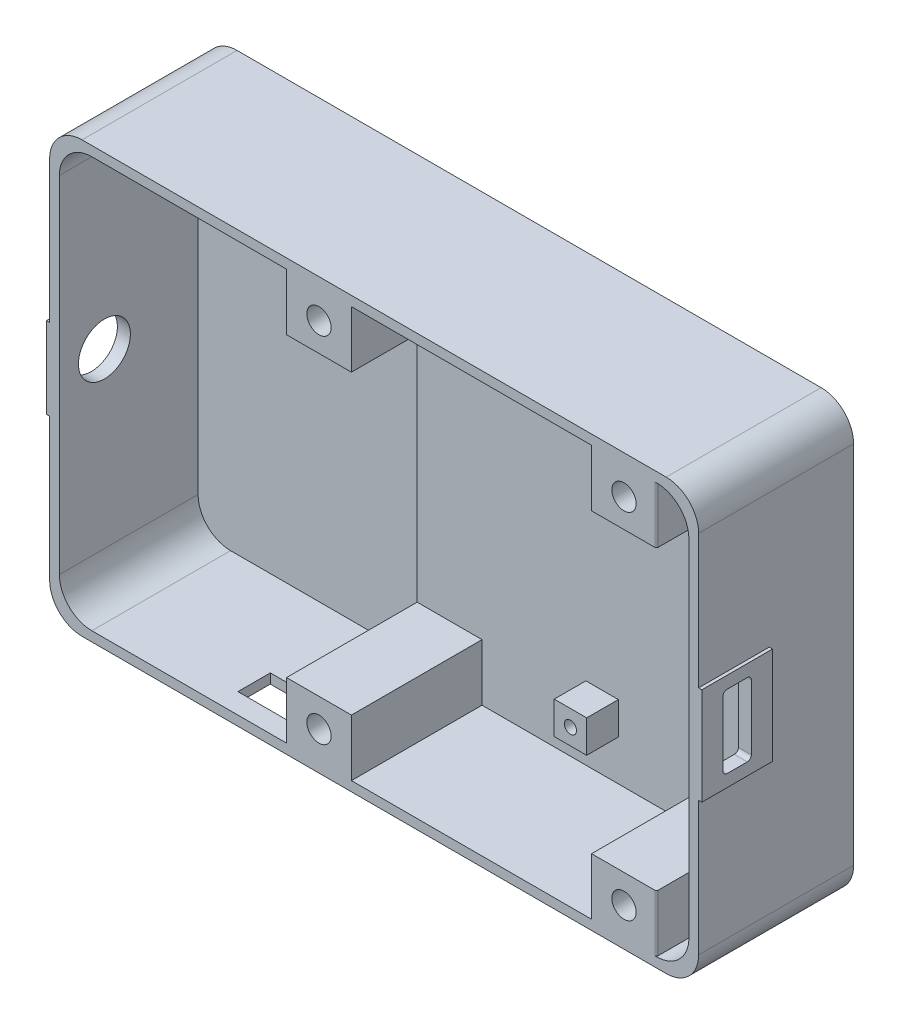
from build123d import *

# Parameters (mm, degrees)
ESQUISSE1_W                         = 80
ESQUISSE1_H                         = 53
BOSS_EXTRU_1_DEPTH                  = 19.1
ESQUISSE3_W                         = 77.6
ESQUISSE3_H                         = 50.6
ENL_V_MAT_EXTRU_1_DEPTH             = 16.1
CONG_1_R                            = 4
ESQUISSE9_W                         = 8
ESQUISSE9_H                         = 7
BOSS_EXTRU_2_DEPTH                  = 16.1
ESQUISSE11_R                        = 1.5
ENL_V_MAT_EXTRU_2_DEPTH             = 13.1
ESQUISSE14_W                        = 8
ESQUISSE14_H                        = 7
BOSS_EXTRU_3_DEPTH                  = 16.1
ESQUISSE15_R                        = 1.5
ENL_V_MAT_EXTRU_3_DEPTH             = 13.1
ESQUISSE45_W                        = 8.7
ESQUISSE45_H                        = 12
BOSS_EXTRU_8_DEPTH                  = 0.4
ENL_V_MAT_EXTRU_4_REACH             = 88.412
ESQUISSE18_W                        = 3.5
ESQUISSE18_H                        = 9
ENL_V_MAT_EXTRU_4_DIRECTION_2_DEPTH = 87.412151923
CONG_2_R                            = 0.5
ESQUISSE33_W                        = 4
ESQUISSE33_H                        = 4
BOSS_EXTRU_6_DEPTH                  = 3.9
ESQUISSE35_R                        = 0.75
ENL_V_MAT_EXTRU_6_DEPTH             = 2.9
ENL_V_START                         = -1
ENL_V_MAT_EXTRU_7_DEPTH             = 1
CONG_4_R                            = 0.5
ESQUISSE42_W                        = 11.1
ESQUISSE42_H                        = 10
BOSS_EXTRU_9_DEPTH                  = 1.6
ENL_V_MAT_EXTRU_9_REACH             = 88.783
ESQUISSE40_R                        = 3.2
ENL_V_MAT_EXTRU_9_DIRECTION_2_DEPTH = 87.782601943
CONG_5_R                            = 0.2
ENL_V_MAT_EXTRU_10_REACH            = 71.325
ESQUISSE53_W                        = 8.5
ESQUISSE53_H                        = 4


with BuildPart() as part:
    # Esquisse1 → Boss.-Extru.1 (new body)
    with BuildSketch(Plane.XY):
        Rectangle(ESQUISSE1_W, ESQUISSE1_H)
    extrude(amount=BOSS_EXTRU_1_DEPTH)

    # Esquisse3 → Enlèv. mat.-Extru.1 (cut)
    with BuildSketch(Plane.XY.offset(19.1)):
        Rectangle(ESQUISSE3_W, ESQUISSE3_H)
    extrude(amount=-ENL_V_MAT_EXTRU_1_DEPTH, mode=Mode.SUBTRACT)

    # Congé1
    cong_1_edges = [part.edges().sort_by_distance(p)[0] for p in [
        (38.8, 25.3, 11.05),
        (38.8, -25.3, 11.05),
        (-38.8, -25.3, 11.05),
        (-38.8, 25.3, 11.05),
        (40, -26.5, 9.55),
        (-40, -26.5, 9.55),
        (-40, 26.5, 9.55),
        (40, 26.5, 9.55),
    ]]
    fillet(cong_1_edges, radius=CONG_1_R)

    # Esquisse9 → Boss.-Extru.2 (add)
    with BuildSketch(Plane.XY.offset(3)):
        with Locations((-6.8, -21.8)):
            Rectangle(ESQUISSE9_W, ESQUISSE9_H)
    boss_extru_2 = extrude(amount=BOSS_EXTRU_2_DEPTH)

    # Esquisse11 → Enlèv. mat.-Extru.2 (cut)
    with BuildSketch(Plane.XY.offset(19.1)):
        with Locations((-6.8, -21.8)):
            Circle(ESQUISSE11_R)
    enl_v_mat_extru_2 = extrude(amount=-ENL_V_MAT_EXTRU_2_DEPTH, mode=Mode.SUBTRACT)

    # Symétrie2: Boss.-Extru.2, Enlèv. mat.-Extru.2 across plane
    add(boss_extru_2.mirror(Plane.ZX))
    add(enl_v_mat_extru_2.mirror(Plane.ZX), mode=Mode.SUBTRACT)

    # Esquisse14 → Boss.-Extru.3 (add)
    with BuildSketch(Plane.XY.offset(3)):
        with Locations((30.8, -21.8)):
            Rectangle(ESQUISSE14_W, ESQUISSE14_H)
    boss_extru_3 = extrude(amount=BOSS_EXTRU_3_DEPTH)

    # Esquisse15 → Enlèv. mat.-Extru.3 (cut)
    with BuildSketch(Plane.XY.offset(19.1)):
        with Locations((30.8, -21.8)):
            Circle(ESQUISSE15_R)
    enl_v_mat_extru_3 = extrude(amount=-ENL_V_MAT_EXTRU_3_DEPTH, mode=Mode.SUBTRACT)

    # Symétrie3: Boss.-Extru.3, Enlèv. mat.-Extru.3 across plane
    add(boss_extru_3.mirror(Plane.ZX))
    add(enl_v_mat_extru_3.mirror(Plane.ZX), mode=Mode.SUBTRACT)

    # Esquisse45 → Boss.-Extru.8 (add)
    with BuildSketch(Plane(origin=(40, 0, 0), x_dir=(0, 0, -1), z_dir=(1, 0, 0))):
        with Locations((-14.75, 0)):
            Rectangle(ESQUISSE45_W, ESQUISSE45_H)
    extrude(amount=BOSS_EXTRU_8_DEPTH)

    # Esquisse18 → Enlèv. mat.-Extru.4 (cut, up to next)
    with BuildSketch(Plane(origin=(40, 0, 0), x_dir=(0, 0, -1), z_dir=(1, 0, 0)), mode=Mode.PRIVATE) as enl_v_mat_extru_4_sk1:
        with Locations((-14.75, 0)):
            Rectangle(ESQUISSE18_W, ESQUISSE18_H)
    enl_v_mat_extru_4_tool1 = extrude(enl_v_mat_extru_4_sk1.sketch, amount=-ENL_V_MAT_EXTRU_4_REACH, mode=Mode.PRIVATE) & part.part
    add(enl_v_mat_extru_4_tool1.solids().sort_by_distance((40, 0, 14.75))[0], mode=Mode.SUBTRACT)

    # Esquisse18 → Enlèv. mat.-Extru.4 direction 2 (cut)
    with BuildSketch(Plane(origin=(40, 0, 0), x_dir=(0, 0, -1), z_dir=(1, 0, 0))):
        with Locations((-14.75, 0)):
            Rectangle(ESQUISSE18_W, ESQUISSE18_H)
    extrude(amount=ENL_V_MAT_EXTRU_4_DIRECTION_2_DEPTH, mode=Mode.SUBTRACT)

    # Congé2
    cong_2_edges = [part.edges().sort_by_distance(p)[0] for p in [
        (39.6, -4.5, 13),
        (39.6, 4.5, 13),
        (39.6, 4.5, 16.5),
        (39.6, -4.5, 16.5),
    ]]
    fillet(cong_2_edges, radius=CONG_2_R)

    # Esquisse33 → Boss.-Extru.6 (add)
    with BuildSketch(Plane.XY.offset(3)):
        with Locations((12, -18.3)):
            Rectangle(ESQUISSE33_W, ESQUISSE33_H)
    boss_extru_6 = extrude(amount=BOSS_EXTRU_6_DEPTH)

    # Esquisse35 → Enlèv. mat.-Extru.6 (cut)
    with BuildSketch(Plane.XY.offset(6.9)):
        with Locations((12, -18.3)):
            Circle(ESQUISSE35_R)
    enl_v_mat_extru_6 = extrude(amount=-ENL_V_MAT_EXTRU_6_DEPTH, mode=Mode.SUBTRACT)

    # Symétrie4: Boss.-Extru.6, Enlèv. mat.-Extru.6 across plane
    add(boss_extru_6.mirror(Plane.ZX))
    add(enl_v_mat_extru_6.mirror(Plane.ZX), mode=Mode.SUBTRACT)

    # Esquisse38 → Enlèv. mat.-Extru.7 (cut)
    with BuildSketch(Plane.XY.offset(3).offset(ENL_V_START)):
        with BuildLine():
            Line((-10.8, -25.3), (-10.8, 25.3))
            Line((-10.8, 25.3), (-34.8, 25.3))
            ThreePointArc((-34.8, 25.3), (-37.628427125, 24.128427125), (-38.8, 21.3))
            Line((-38.8, 21.3), (-38.8, -21.3))
            ThreePointArc((-38.8, -21.3), (-37.628427125, -24.128427125), (-34.8, -25.3))
            Line((-34.8, -25.3), (-10.8, -25.3))
        make_face()
    extrude(amount=ENL_V_MAT_EXTRU_7_DEPTH, mode=Mode.SUBTRACT)

    # Congé4
    cong_4_edges = [part.edges().sort_by_distance(p)[0] for p in [
        (-10.8, 0, 2),
    ]]
    fillet(cong_4_edges, radius=CONG_4_R)

    # Esquisse42 → Boss.-Extru.9 (add)
    with BuildSketch(Plane(origin=(-38.8, 0, 0), x_dir=(0, 0, -1), z_dir=(1, 0, 0))):
        with Locations((-13.55, 0)):
            Rectangle(ESQUISSE42_W, ESQUISSE42_H)
    extrude(amount=-BOSS_EXTRU_9_DEPTH)

    # Esquisse40 → Enlèv. mat.-Extru.9 (cut, up to next)
    with BuildSketch(Plane.ZY.offset(40), mode=Mode.PRIVATE) as enl_v_mat_extru_9_sk1:
        with Locations((13.55, 0)):
            Circle(ESQUISSE40_R)
    enl_v_mat_extru_9_tool1 = extrude(enl_v_mat_extru_9_sk1.sketch, amount=-ENL_V_MAT_EXTRU_9_REACH, mode=Mode.PRIVATE) & part.part
    add(enl_v_mat_extru_9_tool1.solids().sort_by_distance((-40, 0, 13.55))[0], mode=Mode.SUBTRACT)

    # Esquisse40 → Enlèv. mat.-Extru.9 direction 2 (cut)
    with BuildSketch(Plane.ZY.offset(40)):
        with Locations((13.55, 0)):
            Circle(ESQUISSE40_R)
    extrude(amount=ENL_V_MAT_EXTRU_9_DIRECTION_2_DEPTH, mode=Mode.SUBTRACT)

    # Congé5
    cong_5_edges = [part.edges().sort_by_distance(p)[0] for p in [
        (34.8, -21.8, 19.1),
        (34.8, 21.8, 19.1),
    ]]
    fillet(cong_5_edges, radius=CONG_5_R)

    # Esquisse53 → Enlèv. mat.-Extru.10 (cut, up to next)
    with BuildSketch(Plane(origin=(0, -26.5, 0), x_dir=(-1, 0, 0), z_dir=(0, -1, 0)), mode=Mode.PRIVATE) as enl_v_mat_extru_10_sk1:
        with Locations((15.05, -14.6)):
            Rectangle(ESQUISSE53_W, ESQUISSE53_H)
    enl_v_mat_extru_10_tool1 = extrude(enl_v_mat_extru_10_sk1.sketch, amount=-ENL_V_MAT_EXTRU_10_REACH, mode=Mode.PRIVATE) & part.part
    add(enl_v_mat_extru_10_tool1.solids().sort_by_distance((-15.05, -26.5, 14.6))[0], mode=Mode.SUBTRACT)


solid = part.part
